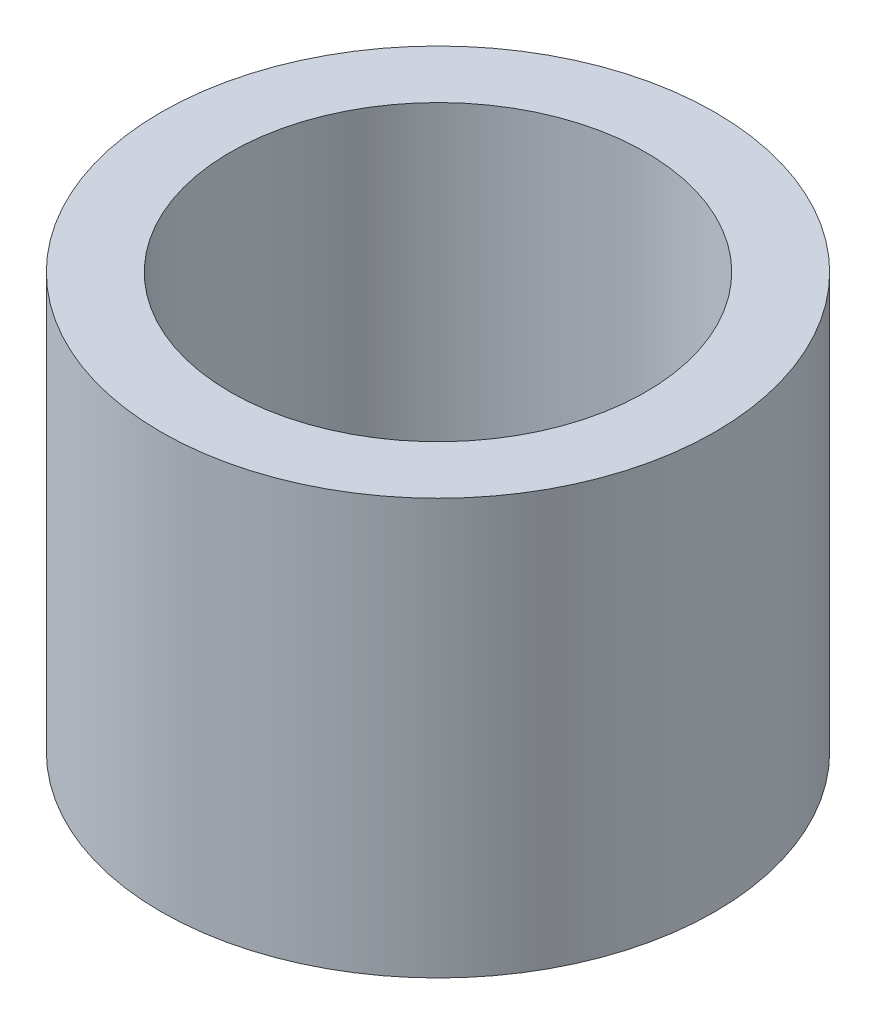
from build123d import *

# Parameters (mm, degrees)
SKETCH1_R           = 10
SKETCH1_R_2         = 7.5
BOSS_EXTRUDE1_DEPTH = 15


with BuildPart() as part:
    # Sketch1 → Boss-Extrude1 (new body)
    with BuildSketch(Plane(origin=(0, 0, 0), x_dir=(1, 0, 0), z_dir=(0, 1, 0))):
        with Locations(Location((0, 0, 0), (0, 0, 270))):
            Circle(SKETCH1_R)
        with Locations(Location((0, 0, 0), (0, 0, 270))):
            Circle(SKETCH1_R_2, mode=Mode.SUBTRACT)
    extrude(amount=BOSS_EXTRUDE1_DEPTH)


solid = part.part
